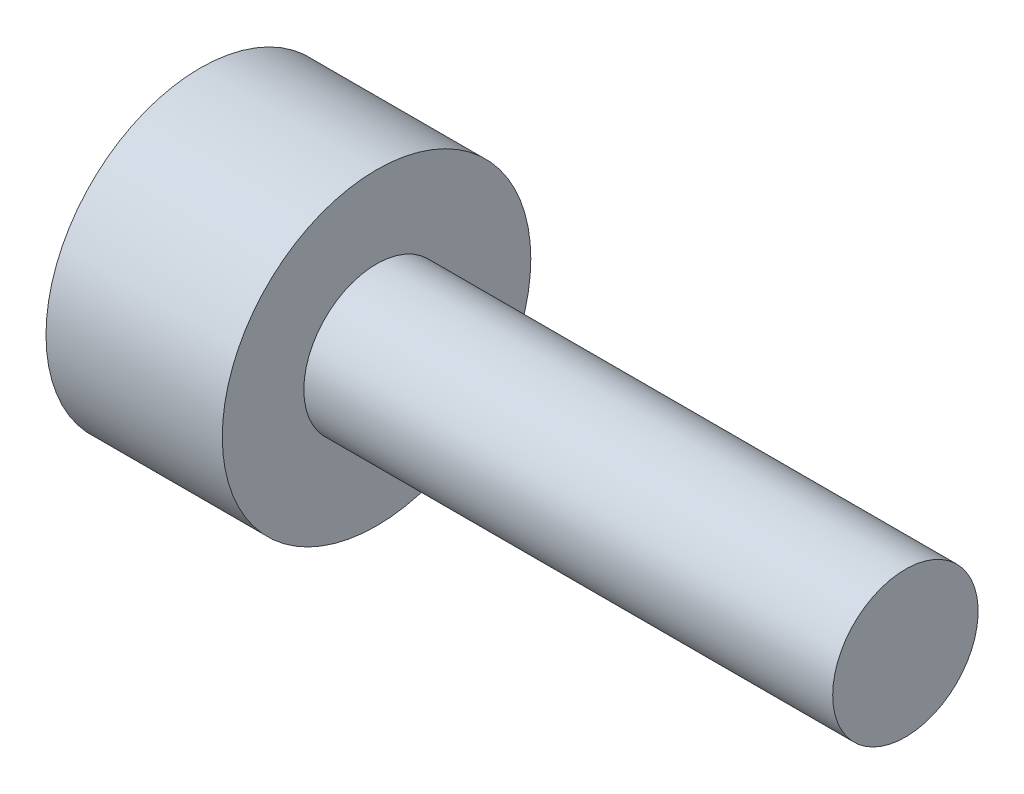
from build123d import *

# Parameters (mm, degrees)
SOCKET_DEPTH = 2


with BuildPart() as part:
    # Screw Sketch → Screw (revolve)
    with BuildSketch(Plane.XY):
        Polygon((-4, 0), (-4, 3.5), (0, 3.5), (0, 1.65), (12, 1.65), (12, 0), align=None)
    revolve(axis=Axis((-1000, 0, 0), (1, 0, 0)))

    # Socket Sketch → Socket (cut)
    with BuildSketch(Plane(origin=(-4, 0, 0), x_dir=(0, 0, -1), z_dir=(1, 0, 0))):
        Polygon((1.732050808, 0), (0.866025404, 1.5), (-0.866025404, 1.5), (-1.732050808, 0), (-0.866025404, -1.5), (0.866025404, -1.5), align=None)
    extrude(amount=SOCKET_DEPTH, mode=Mode.SUBTRACT)


solid = part.part
